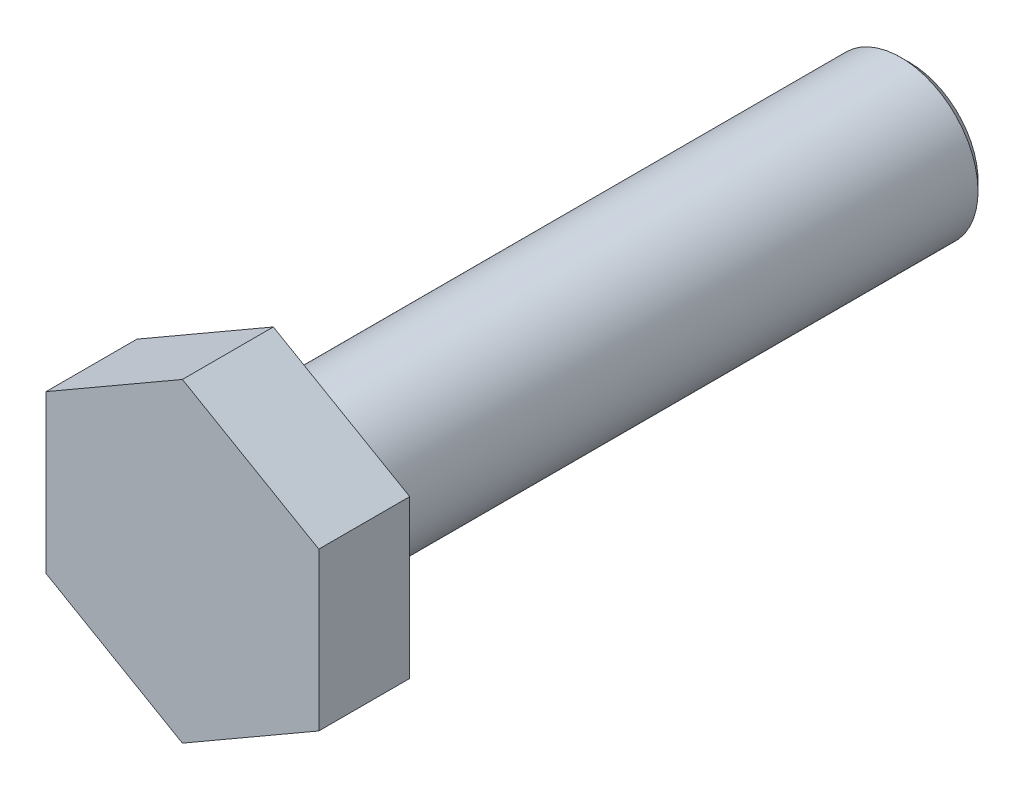
from build123d import *

# Parameters (mm, degrees)
RESSALTO_EXTRUS_O1_DEPTH = 10
ESBO_O2_R                = 8.5
RESSALTO_EXTRUS_O2_DEPTH = 70
ESBO_O3_W                = 6
ESBO_O3_H                = 3.485279131
CORTE_EXTRUS_O1_DEPTH    = 40
FILETE1_R                = 2
CHANFRO1_SIZE            = 1


with BuildPart() as part:
    # Esboço1 → Ressalto-extrusão1 (new body)
    with BuildSketch(Plane.XY):
        Polygon((0, 17.320508076), (-15, 8.660254038), (-15, -8.660254038), (0, -17.320508076), (15, -8.660254038), (15, 8.660254038), align=None)
    extrude(amount=-RESSALTO_EXTRUS_O1_DEPTH)

    # Esboço2 → Ressalto-extrusão2 (add)
    with BuildSketch(Plane(origin=(0, 0, -10), x_dir=(-1, 0, 0), z_dir=(0, 0, -1))):
        Circle(ESBO_O2_R)
    extrude(amount=RESSALTO_EXTRUS_O2_DEPTH)

    # Esboço3 → Corte-extrusão1 (cut)
    with BuildSketch(Plane(origin=(0, 0, -80), x_dir=(-1, 0, 0), z_dir=(0, 0, -1))):
        with Locations((0, -7.042639566)):
            Rectangle(ESBO_O3_W, ESBO_O3_H)
    extrude(amount=-CORTE_EXTRUS_O1_DEPTH, mode=Mode.SUBTRACT)

    # Filete1
    filete1_edges = [part.edges().sort_by_distance(p)[0] for p in [
        (-3, -6.62649343, -40),
        (3, -6.62649343, -40),
    ]]
    fillet(filete1_edges, radius=FILETE1_R)

    # Chanfro1
    chanfro1_edges = [part.edges().sort_by_distance(p)[0] for p in [
        (4.834769901, 6.991065727, -80),
    ]]
    chamfer(chanfro1_edges, length=CHANFRO1_SIZE)


solid = part.part
